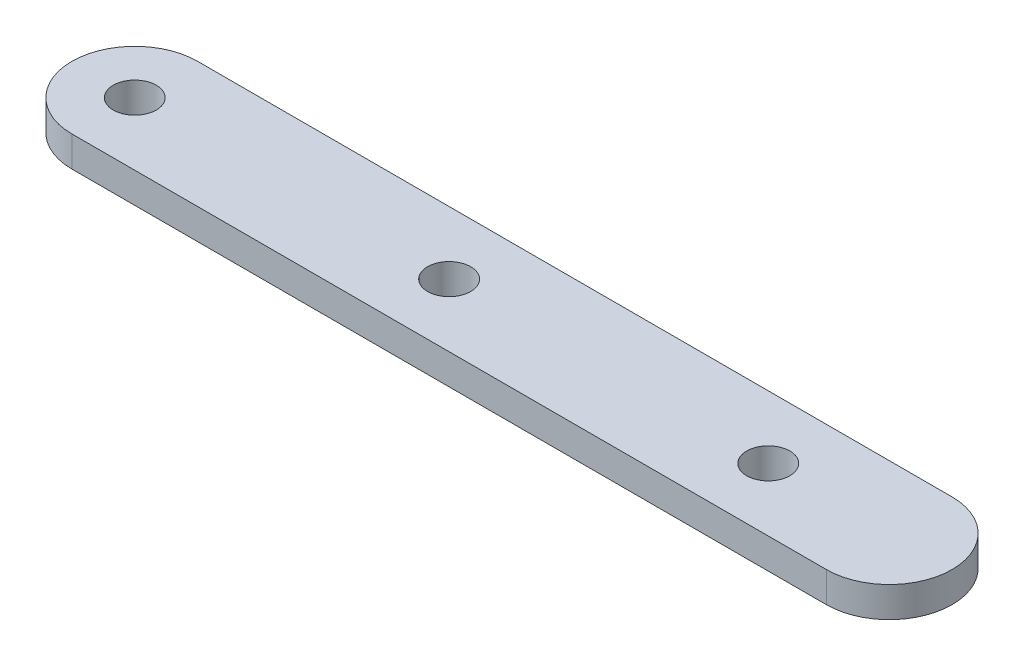
from build123d import *

# Parameters (mm, degrees)
BOSS_EXTRUDE1_DEPTH = 3.075
SKETCH2_R           = 2.175
CUT_EXTRUDE2_DEPTH  = 6.35


with BuildPart() as part:
    # Sketch1 → Boss-Extrude1 (new body)
    with BuildSketch(Plane(origin=(0, 0, 0), x_dir=(1, 0, 0), z_dir=(0, 1, 0))):
        with BuildLine():
            Line((-62.844661922, 8.700177936), (13.355338078, 8.700177936))
            ThreePointArc((13.355338078, 8.700177936), (19.705338078, 2.350177936), (13.355338078, -3.999822064))
            Line((13.355338078, -3.999822064), (-62.844661922, -3.999822064))
            ThreePointArc((-62.844661922, -3.999822064), (-69.194661922, 2.350177936), (-62.844661922, 8.700177936))
        make_face()
    extrude(amount=BOSS_EXTRUDE1_DEPTH)

    # Sketch2 → Cut-Extrude2 (cut)
    with BuildSketch(Plane(origin=(0, 3.075, 0), x_dir=(1, 0, 0), z_dir=(0, 1, 0))):
        with Locations(Location((-62.844661922, 2.350177936, 0), (0, 0, 270))):
            Circle(SKETCH2_R)
        with Locations(Location((-31.094661922, 2.350177936, 0), (0, 0, 270))):
            Circle(SKETCH2_R)
        with Locations(Location((1.135338078, 2.350177936, 0), (0, 0, 270))):
            Circle(SKETCH2_R)
    extrude(amount=-CUT_EXTRUDE2_DEPTH, mode=Mode.SUBTRACT)


solid = part.part
